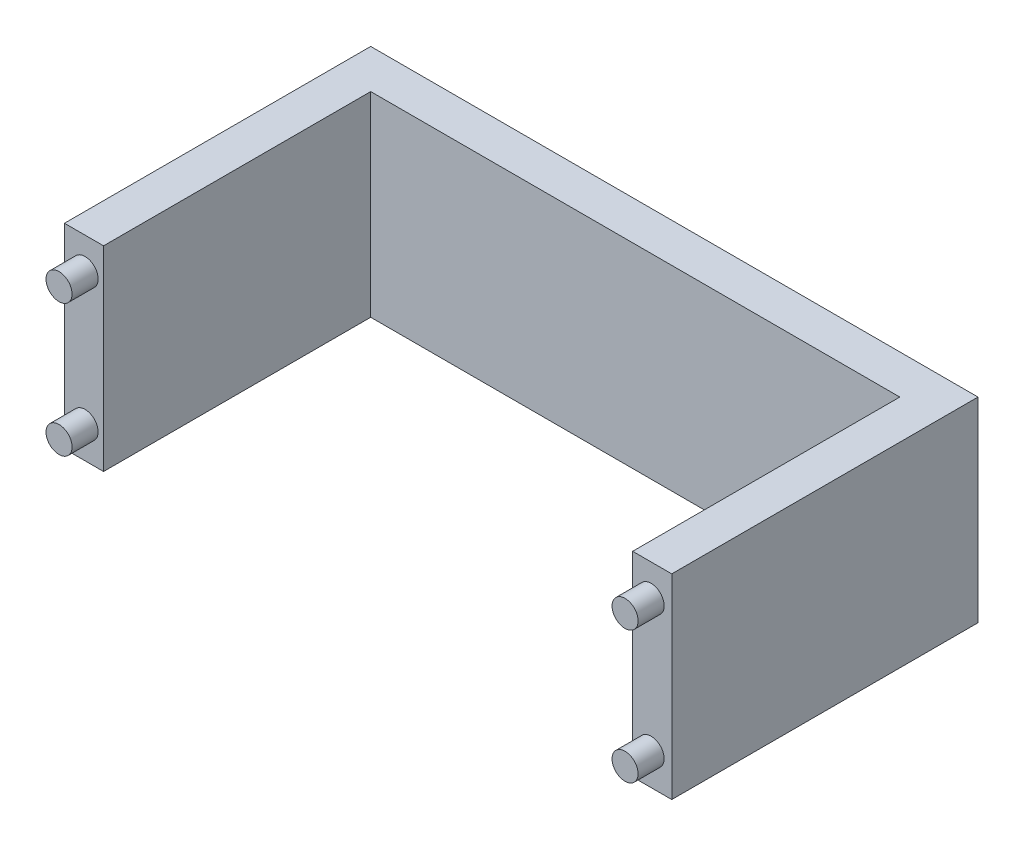
from build123d import *

# Parameters (mm, degrees)
BOSS_EXTRUDE2_DEPTH = 15
SKETCH4_R           = 1
BOSS_EXTRUDE3_DEPTH = 2


with BuildPart() as part:
    # Sketch2 → Boss-Extrude2 (new body)
    with BuildSketch(Plane(origin=(0, 0, 0), x_dir=(1, 0, 0), z_dir=(0, 1, 0))):
        Polygon((0, 0), (0, 23.5), (46.6, 23.5), (46.6, 0), (43.6, 0), (43.6, 20.5), (3, 20.5), (3, 0), align=None)
    extrude(amount=BOSS_EXTRUDE2_DEPTH)

    # Sketch4 → Boss-Extrude3 (add)
    with BuildSketch(Plane.XY):
        with Locations(Location((1.583, 2.42, 0), (0, 0, 180))):
            Circle(SKETCH4_R)
        with Locations(Location((1.583, 12.58, 0), (0, 0, 180))):
            Circle(SKETCH4_R)
        with Locations(Location((45.017, 12.58, 0), (0, 0, 180))):
            Circle(SKETCH4_R)
        with Locations(Location((45.017, 2.42, 0), (0, 0, 180))):
            Circle(SKETCH4_R)
    extrude(amount=BOSS_EXTRUDE3_DEPTH)


solid = part.part
